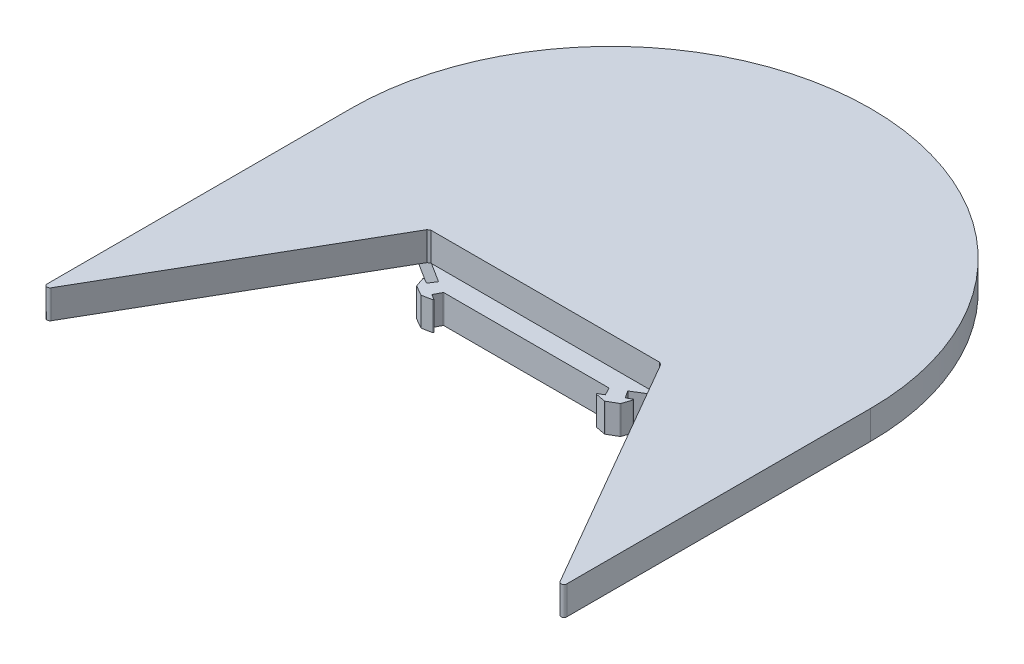
from build123d import *

# Parameters (mm, degrees)
BOSS_EXTRU_1_DEPTH = 5
BOSS_EXTRU_2_DEPTH = 5
CONG_1_R           = 0.1


with BuildPart() as part:
    # Esquisse1 → Boss.-Extru.1 (new body)
    with BuildSketch(Plane(origin=(0, 0, 0), x_dir=(1, 0, 0), z_dir=(0, 1, 0))):
        with BuildLine():
            Line((19.464682141, -16.403463282), (-20.535317859, -16.403463282))
            Line((-20.535317859, -16.403463282), (-20.968330561, -16.653463282))
            Line((-20.968330561, -16.653463282), (-45.035317859, -58.338708067))
            ThreePointArc((-45.035317859, -58.338708067), (-45.597740084, -58.57167098), (-45.968330561, -58.088708067))
            Line((-45.968330561, -58.088708067), (-45.968330561, -4.954733471))
            ThreePointArc((-45.968330561, -4.954733471), (-0.535317859, 40.478279231), (44.897694842, -4.954733471))
            Line((44.897694842, -4.954733471), (44.897694842, -58.088708067))
            ThreePointArc((44.897694842, -58.088708067), (44.527104365, -58.57167098), (43.964682141, -58.338708067))
            Line((43.964682141, -58.338708067), (19.897694842, -16.653463282))
            Line((19.897694842, -16.653463282), (19.464682141, -16.403463282))
        make_face()
    extrude(amount=BOSS_EXTRU_1_DEPTH)

    # Esquisse3 → Boss.-Extru.2 (add)
    with BuildSketch(Plane.XZ):
        with BuildLine():
            Line((-17.908394248, 19.818657818), (-17.084754205, 18.533779345))
            Line((-17.084754205, 18.533779345), (-33.79214282, 7.957290442))
            ThreePointArc((-33.79214282, 7.957290442), (-34.004929664, 7.395599901), (-33.524704444, 7.034825396))
            Line((-33.524704444, 7.034825396), (33.003204413, 7.034825396))
            ThreePointArc((33.003204413, 7.034825396), (33.484427413, 7.399088796), (33.264482707, 7.961127698))
            Line((33.264482707, 7.961127698), (16.014118486, 18.533779345))
            Line((16.014118486, 18.533779345), (16.837758529, 19.818657818))
            Line((16.837758529, 19.818657818), (17.939784376, 19.182402899))
            Line((17.939784376, 19.182402899), (17.287895758, 21.086077969))
            Line((17.287895758, 21.086077969), (15.515071867, 22.109618319))
            Line((15.515071867, 22.109618319), (13.540496587, 21.722332888))
            Line((13.540496587, 21.722332888), (14.642522434, 21.086077969))
            Line((14.642522434, 21.086077969), (13.941605057, 19.730345531))
            Line((13.941605057, 19.730345531), (-15.012240776, 19.730345531))
            Line((-15.012240776, 19.730345531), (-15.713158153, 21.086077969))
            Line((-15.713158153, 21.086077969), (-14.611132306, 21.722332888))
            Line((-14.611132306, 21.722332888), (-16.585707586, 22.109618319))
            Line((-16.585707586, 22.109618319), (-18.358531477, 21.086077969))
            Line((-18.358531477, 21.086077969), (-19.010420095, 19.182402899))
            Line((-19.010420095, 19.182402899), (-17.908394248, 19.818657818))
        make_face()
    extrude(amount=BOSS_EXTRU_2_DEPTH)

    # Congé1
    cong_1_edges = [part.edges().sort_by_distance(p)[0] for p in [
        (16.837758529, -2.5, 19.818657818),
        (17.939784376, -2.5, 19.182402899),
        (17.287895758, -2.5, 21.086077969),
        (15.515071867, -2.5, 22.109618319),
        (13.540496587, -2.5, 21.722332888),
        (13.941605057, -2.5, 19.730345531),
        (-15.012240776, -2.5, 19.730345531),
        (-15.713158153, -2.5, 21.086077969),
        (-14.611132306, -2.5, 21.722332888),
        (-16.585707586, -2.5, 22.109618319),
        (-18.358531477, -2.5, 21.086077969),
        (-19.010420095, -2.5, 19.182402899),
        (-17.908394248, -2.5, 19.818657818),
        (-17.084754205, -2.5, 18.533779345),
    ]]
    fillet(cong_1_edges, radius=CONG_1_R)


solid = part.part
